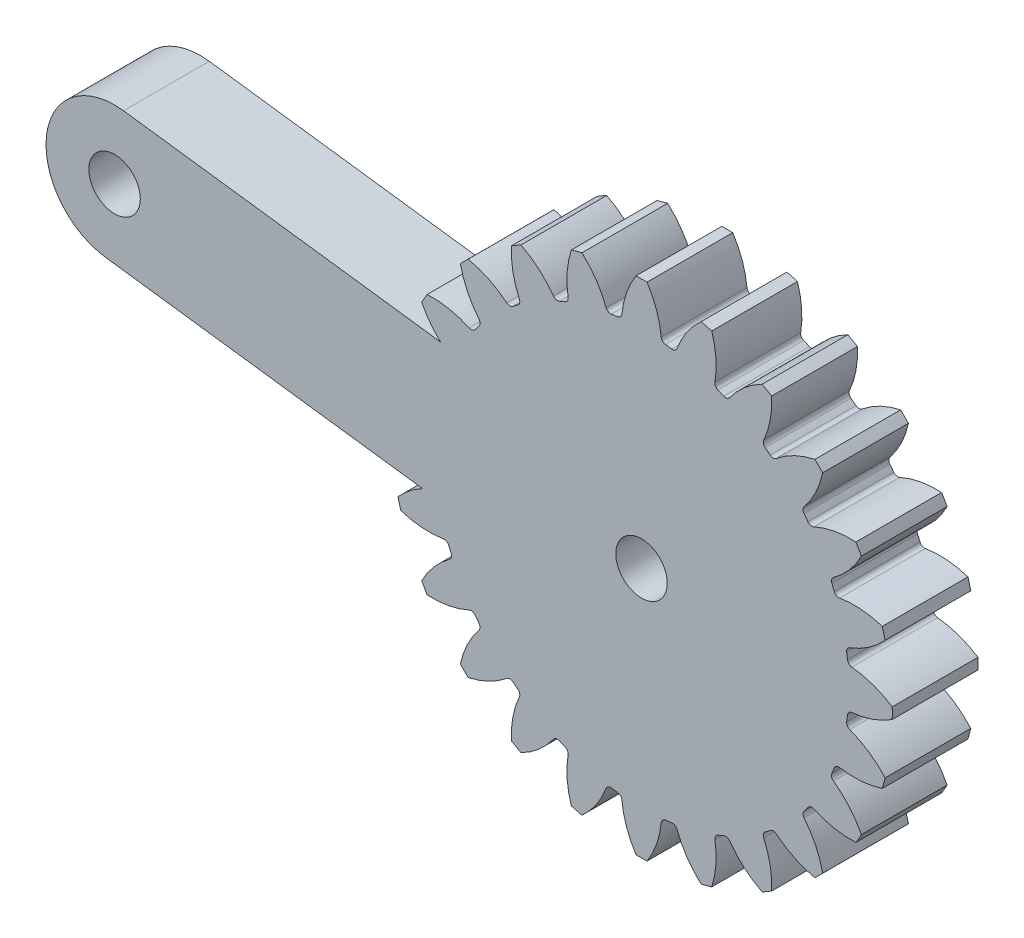
from build123d import *

# Parameters (mm, degrees)
SKETCH_1_R                       = 12.09375
SKETCH_1_R_2                     = 1.5
EXTRUDE_2_DEPTH                  = 5
EXTRUDE_3_DEPTH                  = 5
FILLET_2_R                       = 0.28125
PATTERN_CIRCULAR_1_COUNT         = 24
FILLET_2_OF_PATTERN_CIRCULAR_1_R = 0.28125
EXTRUDE_START                    = -5
SKETCH_2_R                       = 1.5
EXTRUDE_4_DEPTH                  = 5


with BuildPart() as part:
    # 스케치1 → 보스-돌출2 (new body)
    with BuildSketch(Plane.XY):
        Circle(SKETCH_1_R)
        Circle(SKETCH_1_R_2, mode=Mode.SUBTRACT)
    extrude(amount=EXTRUDE_2_DEPTH)

    # 스케치1<4> → 보스-돌출3 (add)
    with BuildSketch(Plane.XY):
        with BuildLine():
            ThreePointArc((1.164375, 12.037567027), (0.912091491, 13.384904266), (0.320625, 14.621485034))
            ThreePointArc((0.320625, 14.621485034), (0, 14.625), (-0.320625, 14.621485034))
            ThreePointArc((-0.320625, 14.621485034), (-0.912091491, 13.384904266), (-1.164375, 12.037567027))
            ThreePointArc((-1.164375, 12.037567027), (0, 12.09375), (1.164375, 12.037567027))
        make_face()
    extrude_3 = extrude(amount=EXTRUDE_3_DEPTH)

    # 필렛2
    fillet_2_edges = [part.edges().sort_by_distance(p)[0] for p in [
        (-1.164375, 12.037567027, 2.5),
        (1.164375, 12.037567027, 2.5),
    ]]
    fillet(fillet_2_edges, radius=FILLET_2_R)

    # 원형 패턴1: 보스-돌출3 ×24 about axis
    pattern_circular_1_axis = Axis((0, 0, 0), (0, 0, 1))
    for i in range(1, PATTERN_CIRCULAR_1_COUNT):
        add(extrude_3.rotate(pattern_circular_1_axis, i * 360 / PATTERN_CIRCULAR_1_COUNT))

    # 필렛2 of 원형 패턴1
    fillet_2_of_pattern_circular_1_edges = [part.edges().sort_by_distance(p)[0] for p in [
        (-4.240251487, 11.326034451, 2.5),
        (-1.990851719, 11.928759302, 2.5),
        (-7.027161843, 9.842651345, 2.5),
        (-5.010405184, 11.007026345, 2.5),
        (-9.335182732, 7.688507815, 2.5),
        (-7.688507815, 9.335182732, 2.5),
        (-11.007026345, 5.010405184, 2.5),
        (-9.842651345, 7.027161843, 2.5),
        (-11.928759302, 1.990851719, 2.5),
        (-11.326034451, 4.240251487, 2.5),
        (-12.037567027, -1.164375, 2.5),
        (-12.037567027, 1.164375, 2.5),
        (-11.326034451, -4.240251487, 2.5),
        (-11.928759302, -1.990851719, 2.5),
        (-9.842651345, -7.027161843, 2.5),
        (-11.007026345, -5.010405184, 2.5),
        (-7.688507815, -9.335182732, 2.5),
        (-9.335182732, -7.688507815, 2.5),
        (-5.010405184, -11.007026345, 2.5),
        (-7.027161843, -9.842651345, 2.5),
        (-1.990851719, -11.928759302, 2.5),
        (-4.240251487, -11.326034451, 2.5),
        (1.164375, -12.037567027, 2.5),
        (-1.164375, -12.037567027, 2.5),
        (4.240251487, -11.326034451, 2.5),
        (1.990851719, -11.928759302, 2.5),
        (7.027161843, -9.842651345, 2.5),
        (5.010405184, -11.007026345, 2.5),
        (9.335182732, -7.688507815, 2.5),
        (7.688507815, -9.335182732, 2.5),
        (11.007026345, -5.010405184, 2.5),
        (9.842651345, -7.027161843, 2.5),
        (11.928759302, -1.990851719, 2.5),
        (11.326034451, -4.240251487, 2.5),
        (12.037567027, 1.164375, 2.5),
        (12.037567027, -1.164375, 2.5),
        (11.326034451, 4.240251487, 2.5),
        (11.928759302, 1.990851719, 2.5),
        (9.842651345, 7.027161843, 2.5),
        (11.007026345, 5.010405184, 2.5),
        (7.688507815, 9.335182732, 2.5),
        (9.335182732, 7.688507815, 2.5),
        (5.010405184, 11.007026345, 2.5),
        (7.027161843, 9.842651345, 2.5),
        (1.990851719, 11.928759302, 2.5),
        (4.240251487, 11.326034451, 2.5),
    ]]
    fillet(fillet_2_of_pattern_circular_1_edges, radius=FILLET_2_OF_PATTERN_CIRCULAR_1_R)

    # 스케치2 → 보스-돌출4 (add)
    with BuildSketch(Plane.XY.offset(5).offset(EXTRUDE_START)):
        with BuildLine():
            Line((0.522104769, 3.965779445), (-30.212685934, 8.012091404))
            ThreePointArc((-30.212685934, 8.012091404), (-34.700570148, 4.568416728), (-31.256895471, 0.080532513))
            Line((-31.256895471, 0.080532513), (-0.522104769, -3.965779445))
            ThreePointArc((-0.522104769, -3.965779445), (3.965779445, -0.522104769), (0.522104769, 3.965779445))
        make_face()
        Circle(SKETCH_2_R, mode=Mode.SUBTRACT)
        with Locations((-30.734790703, 4.046311959)):
            Circle(SKETCH_2_R, mode=Mode.SUBTRACT)
    extrude(amount=EXTRUDE_4_DEPTH)


solid = part.part
